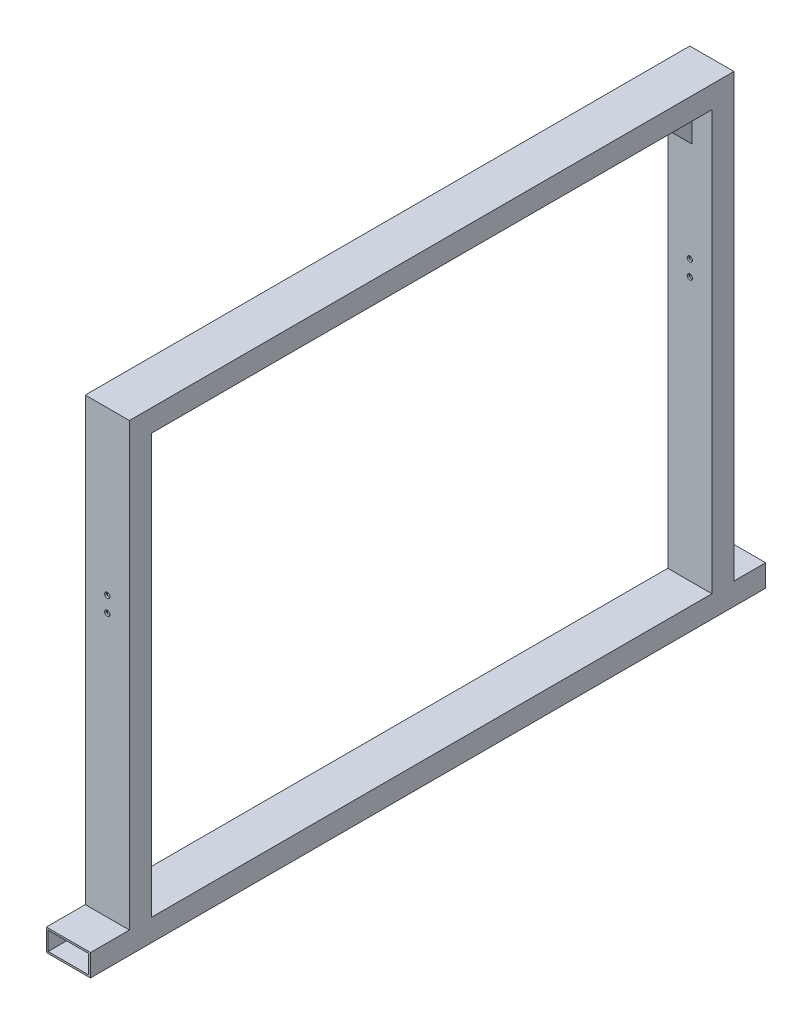
from build123d import *

# Parameters (mm, degrees)
SKETCH1_W           = 50
SKETCH1_H           = 25
SKETCH1_W_2         = 46
SKETCH1_H_2         = 21
BOSS_EXTRUDE1_DEPTH = 765
SKETCH2_W           = 50
SKETCH2_H           = 25
SKETCH2_W_2         = 46
SKETCH2_H_2         = 21
BOSS_EXTRUDE2_DEPTH = 500
BOSS_EXTRUDE3_REACH = 886.875
SKETCH3_W           = 50
SKETCH3_H           = 25
SKETCH3_W_2         = 46
SKETCH3_H_2         = 21
GUSSET1_THICKNESS   = 5
GUSSET2_THICKNESS   = 5
SKETCH9_R           = 3
CUT_EXTRUDE1_DEPTH  = 70
CUT_EXTRUDE2_START  = -70
SKETCH10_R          = 3
CUT_EXTRUDE2_DEPTH  = 70


with BuildPart() as part:
    # Sketch1 → Boss-Extrude1 (new body)
    with BuildSketch(Plane.XY):
        Rectangle(SKETCH1_W, SKETCH1_H)
        Rectangle(SKETCH1_W_2, SKETCH1_H_2, mode=Mode.SUBTRACT)
    extrude(amount=BOSS_EXTRUDE1_DEPTH)

    # Sketch2 → Boss-Extrude2 (add)
    # profile 1 of 2: a face of its own
    with BuildSketch(Plane(origin=(0, 12.5, 0), x_dir=(1, 0, 0), z_dir=(0, 1, 0))):
        with Locations((0, -708.418350439)):
            Rectangle(SKETCH2_W, SKETCH2_H)
        with Locations((0, -708.418350439)):
            Rectangle(SKETCH2_W_2, SKETCH2_H_2, mode=Mode.SUBTRACT)
    # profile 2 of 2: a face of its own
    with BuildSketch(Plane(origin=(0, 12.5, 0), x_dir=(1, 0, 0), z_dir=(0, 1, 0))):
        with Locations((0, -48.418350439)):
            Rectangle(SKETCH2_W, SKETCH2_H)
        with Locations((0, -48.418350439)):
            Rectangle(SKETCH2_W_2, SKETCH2_H_2, mode=Mode.SUBTRACT)
    extrude(amount=BOSS_EXTRUDE2_DEPTH)

    # Boss-Extrude3: up to this face of the body (flat: up to its plane)
    boss_extrude3_end = Plane(part.part.faces().sort_by_distance((0, 262.5, 35.918350439))[0])
    # Sketch3 → Boss-Extrude3 (add, up to the picked face)
    with BuildSketch(Plane.XY.offset(720.918350439), mode=Mode.PRIVATE) as boss_extrude3_sk1:
        with Locations((0, 500)):
            Rectangle(SKETCH3_W, SKETCH3_H)
        with Locations((0, 500)):
            Rectangle(SKETCH3_W_2, SKETCH3_H_2, mode=Mode.SUBTRACT)
    boss_extrude3_tool1 = split(extrude(boss_extrude3_sk1.sketch, amount=-BOSS_EXTRUDE3_REACH, mode=Mode.PRIVATE), bisect_by=boss_extrude3_end, keep=Keep.BOTH, mode=Mode.PRIVATE)
    add(boss_extrude3_tool1.solids().sort_by(Axis((0, 488.059017, 720.91835), (0, 0, -1)))[0])

    # Sketch9 → Cut-Extrude1 (cut)
    with BuildSketch(Plane(origin=(0, 0, 695.918350439), x_dir=(-1, 0, 0), z_dir=(0, 0, -1))):
        with Locations((0, 310.887616871)):
            Circle(SKETCH9_R)
        with Locations((0, 328.5)):
            Circle(SKETCH9_R)
    extrude(amount=-CUT_EXTRUDE1_DEPTH, mode=Mode.SUBTRACT)

    # Sketch10 → Cut-Extrude2 (cut)
    with BuildSketch(Plane.XY.offset(60.918350439).offset(CUT_EXTRUDE2_START)):
        with Locations(Location((0, 310.887616871, 0), (0, 0, 180))):
            Circle(SKETCH10_R)
        with Locations(Location((0, 328.5, 0), (0, 0, 180))):
            Circle(SKETCH10_R)
    extrude(amount=CUT_EXTRUDE2_DEPTH, mode=Mode.SUBTRACT)


with BuildPart() as body_2:
    # Gusset1: a gusset: a plate 5.0 thick in the corner of two members, its outline drawn in place
    gusset1_outline = Wire([Line((2.5, 487.5, 60.918350439), (2.5, 487.5, 105.918350439)), Line((2.5, 487.5, 105.918350439), (2.5, 442.5, 60.918350439)), Line((2.5, 442.5, 60.918350439), (2.5, 487.5, 60.918350439))])
    add(extrude(Face(gusset1_outline), amount=GUSSET1_THICKNESS, dir=(-1, 0, 0)))


with BuildPart() as body_3:
    # Gusset2: a gusset: a plate 5.0 thick in the corner of two members, its outline drawn in place
    gusset2_outline = Wire([Line((2.5, 487.5, 695.918350439), (2.5, 442.5, 695.918350439)), Line((2.5, 442.5, 695.918350439), (2.5, 487.5, 650.918350439)), Line((2.5, 487.5, 650.918350439), (2.5, 487.5, 695.918350439))])
    add(extrude(Face(gusset2_outline), amount=GUSSET2_THICKNESS, dir=(-1, 0, 0)))


solid = Compound([part.part, body_2.part, body_3.part])
